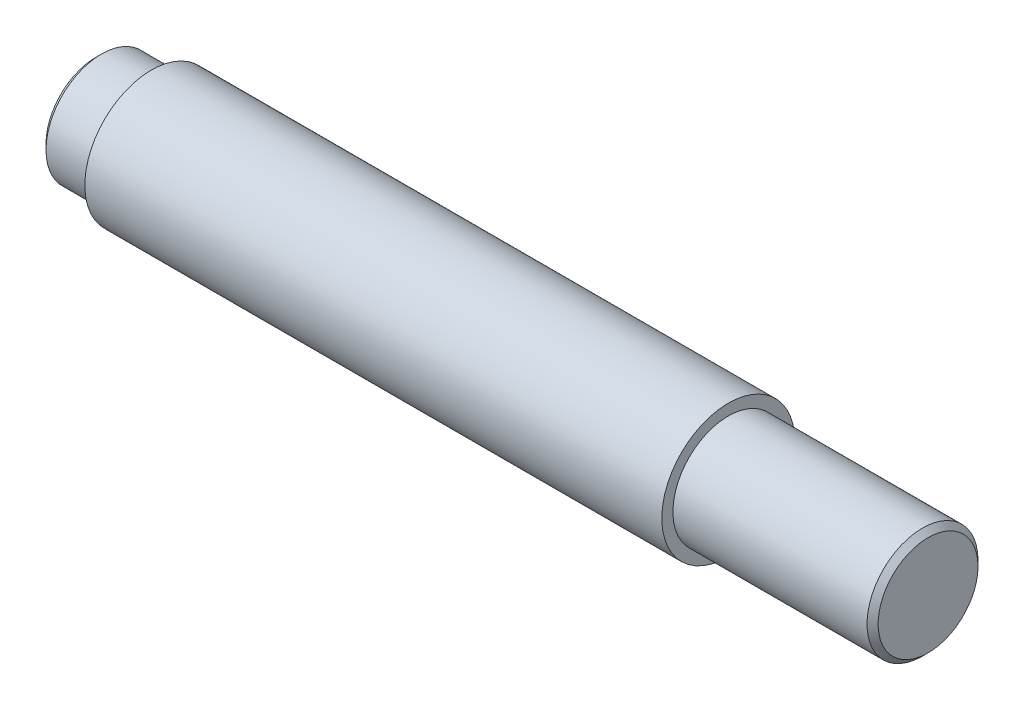
from build123d import *

# Parameters (mm, degrees)
CHAMFER_1_SIZE = 0.5


with BuildPart() as part:
    # 草图1 → 旋转1 (revolve)
    with BuildSketch(Plane(origin=(0, 0, 0), x_dir=(1, 0, 0), z_dir=(0, 1, 0))):
        Polygon((-8.630363036, 0), (-8.630363036, 5), (-3.630363036, 5), (-3.630363036, 6), (48.369636964, 6), (48.369636964, 5), (66.369636964, 5), (66.369636964, 0), align=None)
    revolve(axis=Axis((66.369636964, 0, 0), (-1, 0, 0)))

    # 倒角1
    chamfer_1_edges = [part.edges().sort_by_distance(p)[0] for p in [
        (66.369636964, 0, 5),
        (-8.630363036, 0, 5),
    ]]
    chamfer(chamfer_1_edges, length=CHAMFER_1_SIZE)


solid = part.part
